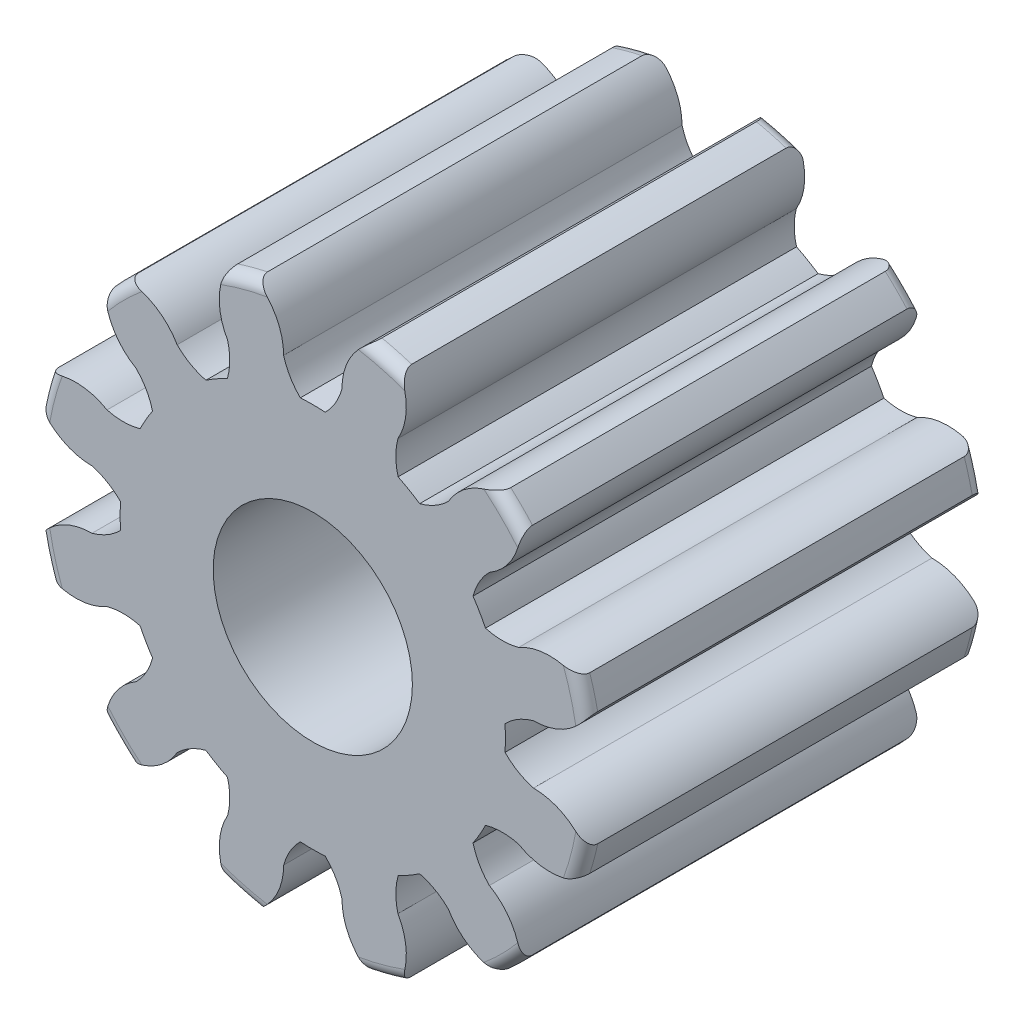
from build123d import *

# Parameters (mm, degrees)
CROQUIS1_R              = 7
CROQUIS1_R_2            = 2.5
SALIENTE_EXTRUIR1_DEPTH = 10
REDONDEO1_R             = 0.3
CORTAR_EXTRUIR1_REACH   = 16.071
MATRIZC1_COUNT          = 12


with BuildPart() as part:
    # Croquis1 → Saliente-Extruir1 (new body)
    with BuildSketch(Plane.XY):
        Circle(CROQUIS1_R)
        Circle(CROQUIS1_R_2, mode=Mode.SUBTRACT)
    extrude(amount=SALIENTE_EXTRUIR1_DEPTH)

    # Redondeo1
    redondeo1_edges = [part.edges().sort_by_distance(p)[0] for p in [
        (-7, 0, 0),
        (-7, 0, 10),
    ]]
    fillet(redondeo1_edges, radius=REDONDEO1_R)

    # Croquis2 → Cortar-Extruir1 (cut, up to next)
    with BuildSketch(Plane.XY.offset(10), mode=Mode.PRIVATE) as cortar_extruir1_sk1:
        with BuildLine():
            ThreePointArc((-0.731941862, 5.540627259), (-0.57044181, 5.154581101), (-0.312745158, 4.824874658))
            ThreePointArc((-0.312745158, 4.824874658), (-0.000325129, 4.834999989), (0.312096258, 4.824916676))
            ThreePointArc((0.312096258, 4.824916676), (0.569748565, 5.154657773), (0.731196697, 5.540725647))
            ThreePointArc((0.731196697, 5.540725647), (1.056093568, 6.497459752), (1.89648596, 7.058386443))
            ThreePointArc((1.89648596, 7.058386443), (-0.000544654, 8.099543472), (-1.897435224, 7.058131321))
            ThreePointArc((-1.897435224, 7.058131321), (-1.056967401, 6.497317659), (-0.731941862, 5.540627259))
        make_face()
    cortar_extruir1_tool1 = extrude(cortar_extruir1_sk1.sketch, amount=-CORTAR_EXTRUIR1_REACH, mode=Mode.PRIVATE) & part.part
    cortar_extruir1 = cortar_extruir1_tool1.solids().sort_by_distance((-0.000452, 6.718134, 10))[0]
    add(cortar_extruir1, mode=Mode.SUBTRACT)

    # MatrizC1: Cortar-Extruir1 ×12 about axis
    matrizc1_axis = Axis((0, 0, 0), (0, 0, 1))
    for i in range(1, MATRIZC1_COUNT):
        add(cortar_extruir1.rotate(matrizc1_axis, i * 360 / MATRIZC1_COUNT), mode=Mode.SUBTRACT)


solid = part.part
